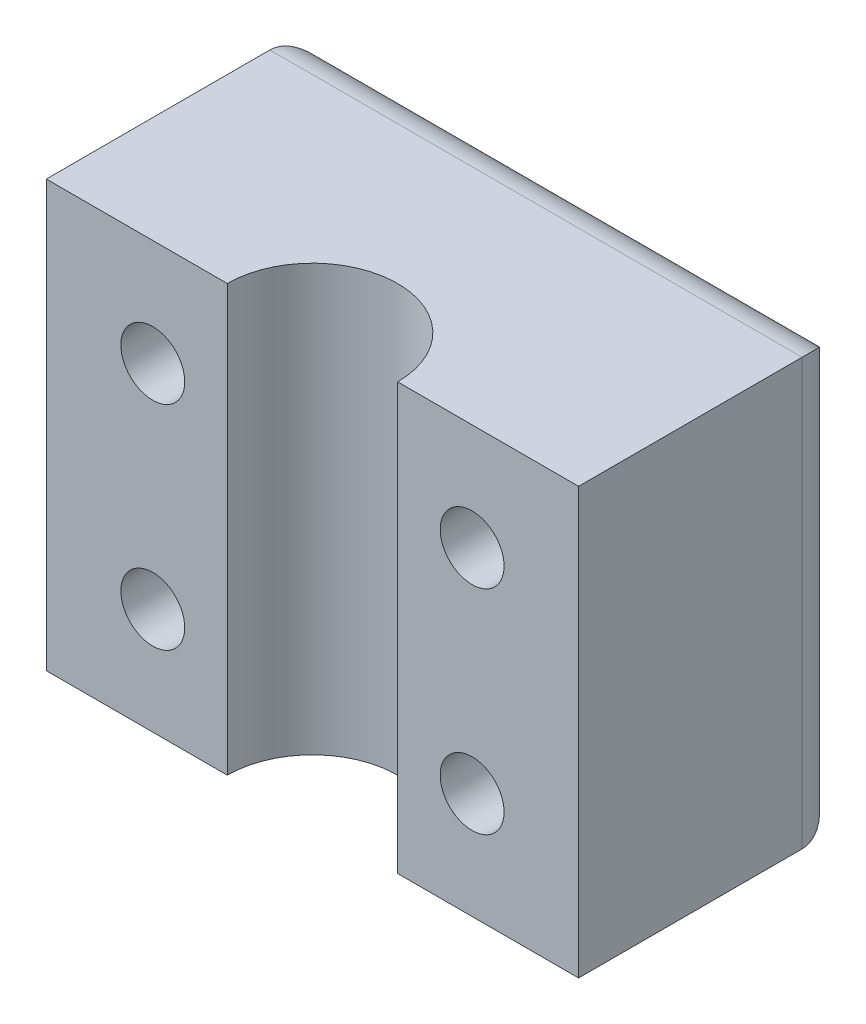
from build123d import *

# Parameters (mm, degrees)
SKETCH1_W           = 50
SKETCH1_H           = 40
BOSS_EXTRUDE1_DEPTH = 25
SKETCH2_R           = 8
CUT_EXTRUDE1_DEPTH  = 43
SKETCH3_R           = 3
CUT_EXTRUDE2_DEPTH  = 43
CUT_EXTRUDE3_DEPTH  = 5
FILLET1_R           = 4


with BuildPart() as part:
    # Sketch1 → Boss-Extrude1 (new body)
    with BuildSketch(Plane.XY):
        with Locations((25, 20)):
            Rectangle(SKETCH1_W, SKETCH1_H)
    extrude(amount=BOSS_EXTRUDE1_DEPTH)

    # Sketch2 → Cut-Extrude1 (cut)
    with BuildSketch(Plane(origin=(0, 40, 0), x_dir=(1, 0, 0), z_dir=(0, 1, 0))):
        with Locations((25, -25)):
            Circle(SKETCH2_R)
    extrude(amount=-CUT_EXTRUDE1_DEPTH, mode=Mode.SUBTRACT)

    # Sketch3 → Cut-Extrude2 (cut)
    with BuildSketch(Plane.XY.offset(25)):
        with Locations((10, 30)):
            Circle(SKETCH3_R)
        with Locations((10, 10)):
            Circle(SKETCH3_R)
        with Locations((40, 30)):
            Circle(SKETCH3_R)
        with Locations((40, 10)):
            Circle(SKETCH3_R)
    extrude(amount=-CUT_EXTRUDE2_DEPTH, mode=Mode.SUBTRACT)

    # Sketch4 → Cut-Extrude3 (cut)
    with BuildSketch(Plane(origin=(0, 0, 0), x_dir=(-1, 0, 0), z_dir=(0, 0, -1))):
        Polygon((-7.113248654, 5), (-4.226497308, 10), (-7.113248654, 15), (-12.886751346, 15), (-15.773502692, 10), (-12.886751346, 5), align=None)
        Polygon((-37.113248654, 5), (-34.226497308, 10), (-37.113248654, 15), (-42.886751346, 15), (-45.773502692, 10), (-42.886751346, 5), align=None)
        Polygon((-7.113248654, 25), (-4.226497308, 30), (-7.113248654, 35), (-12.886751346, 35), (-15.773502692, 30), (-12.886751346, 25), align=None)
        Polygon((-42.886751346, 35), (-45.773502692, 30), (-42.886751346, 25), (-37.113248654, 25), (-34.226497308, 30), (-37.113248654, 35), align=None)
    extrude(amount=-CUT_EXTRUDE3_DEPTH, mode=Mode.SUBTRACT)

    # Fillet1
    fillet1_edges = [part.edges().sort_by_distance(p)[0] for p in [
        (25, 40, 0),
        (50, 20, 0),
        (25, 0, 0),
        (0, 20, 0),
    ]]
    fillet(fillet1_edges, radius=FILLET1_R)


solid = part.part
